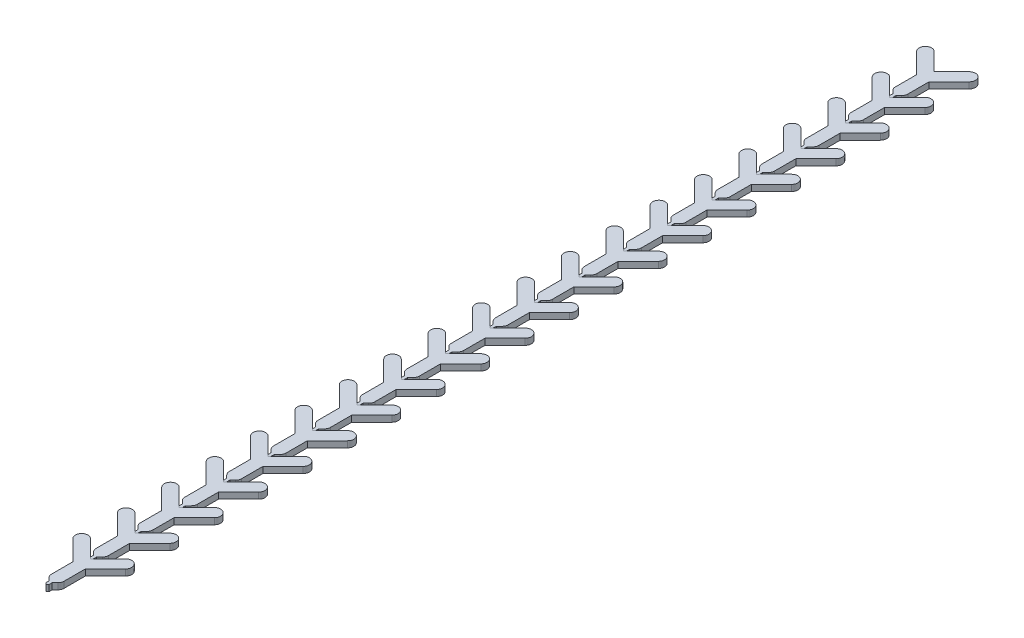
from build123d import *

# Parameters (mm, degrees)
BOSS_EXTRUDE1_DEPTH = 2
LPATTERN2_COUNT     = 20
LPATTERN2_PITCH     = 14.32


with BuildPart() as part:
    # Sketch1 → Boss-Extrude1 (new body)
    with BuildSketch(Plane(origin=(0, 0, 0), x_dir=(1, 0, 0), z_dir=(0, 1, 0))):
        with BuildLine():
            Line((-5.656854249, 8.485281374), (0, 2.828427125))
            Line((0, 2.828427125), (5.656854249, 8.485281374))
            ThreePointArc((5.656854249, 8.485281374), (8.485281374, 8.485281374), (8.485281374, 5.656854249))
            Line((8.485281374, 5.656854249), (2, -0.828427125))
            Line((2, -0.828427125), (2, -7.671572875))
            ThreePointArc((2, -7.671572875), (1.847759065, -8.43693974), (1.414213562, -9.085786438))
            Line((1.414213562, -9.085786438), (0.5, -10))
            Line((0.5, -10), (0.5, -11))
            Line((0.5, -11), (0, -11.5))
            Line((0, -11.5), (-0.5, -11))
            Line((-0.5, -11), (-0.5, -10))
            Line((-0.5, -10), (-1.414213562, -9.085786438))
            ThreePointArc((-1.414213562, -9.085786438), (-1.847759065, -8.43693974), (-2, -7.671572875))
            Line((-2, -7.671572875), (-2, -0.828427125))
            Line((-2, -0.828427125), (-8.485281374, 5.656854249))
            ThreePointArc((-8.485281374, 5.656854249), (-8.485281374, 8.485281374), (-5.656854249, 8.485281374))
        make_face()
    extrude(amount=BOSS_EXTRUDE1_DEPTH)


with BuildPart() as lpattern2_1:
    # LPattern2: pattern copy
    add(part.part.moved(Location(Vector(0, 0, 1) * (1 * LPATTERN2_PITCH))))


with BuildPart() as lpattern2_2:
    # LPattern2: pattern copy
    add(part.part.moved(Location(Vector(0, 0, 1) * (2 * LPATTERN2_PITCH))))


with BuildPart() as lpattern2_3:
    # LPattern2: pattern copy
    add(part.part.moved(Location(Vector(0, 0, 1) * (3 * LPATTERN2_PITCH))))


with BuildPart() as lpattern2_4:
    # LPattern2: pattern copy
    add(part.part.moved(Location(Vector(0, 0, 1) * (4 * LPATTERN2_PITCH))))


with BuildPart() as lpattern2_5:
    # LPattern2: pattern copy
    add(part.part.moved(Location(Vector(0, 0, 1) * (5 * LPATTERN2_PITCH))))


with BuildPart() as lpattern2_6:
    # LPattern2: pattern copy
    add(part.part.moved(Location(Vector(0, 0, 1) * (6 * LPATTERN2_PITCH))))


with BuildPart() as lpattern2_7:
    # LPattern2: pattern copy
    add(part.part.moved(Location(Vector(0, 0, 1) * (7 * LPATTERN2_PITCH))))


with BuildPart() as lpattern2_8:
    # LPattern2: pattern copy
    add(part.part.moved(Location(Vector(0, 0, 1) * (8 * LPATTERN2_PITCH))))


with BuildPart() as lpattern2_9:
    # LPattern2: pattern copy
    add(part.part.moved(Location(Vector(0, 0, 1) * (9 * LPATTERN2_PITCH))))


with BuildPart() as lpattern2_10:
    # LPattern2: pattern copy
    add(part.part.moved(Location(Vector(0, 0, 1) * (10 * LPATTERN2_PITCH))))


with BuildPart() as lpattern2_11:
    # LPattern2: pattern copy
    add(part.part.moved(Location(Vector(0, 0, 1) * (11 * LPATTERN2_PITCH))))


with BuildPart() as lpattern2_12:
    # LPattern2: pattern copy
    add(part.part.moved(Location(Vector(0, 0, 1) * (12 * LPATTERN2_PITCH))))


with BuildPart() as lpattern2_13:
    # LPattern2: pattern copy
    add(part.part.moved(Location(Vector(0, 0, 1) * (13 * LPATTERN2_PITCH))))


with BuildPart() as lpattern2_14:
    # LPattern2: pattern copy
    add(part.part.moved(Location(Vector(0, 0, 1) * (14 * LPATTERN2_PITCH))))


with BuildPart() as lpattern2_15:
    # LPattern2: pattern copy
    add(part.part.moved(Location(Vector(0, 0, 1) * (15 * LPATTERN2_PITCH))))


with BuildPart() as lpattern2_16:
    # LPattern2: pattern copy
    add(part.part.moved(Location(Vector(0, 0, 1) * (16 * LPATTERN2_PITCH))))


with BuildPart() as lpattern2_17:
    # LPattern2: pattern copy
    add(part.part.moved(Location(Vector(0, 0, 1) * (17 * LPATTERN2_PITCH))))


with BuildPart() as lpattern2_18:
    # LPattern2: pattern copy
    add(part.part.moved(Location(Vector(0, 0, 1) * (18 * LPATTERN2_PITCH))))


with BuildPart() as lpattern2_19:
    # LPattern2: pattern copy
    add(part.part.moved(Location(Vector(0, 0, 1) * (19 * LPATTERN2_PITCH))))


solid = Compound([part.part, lpattern2_1.part, lpattern2_2.part, lpattern2_3.part, lpattern2_4.part, lpattern2_5.part, lpattern2_6.part, lpattern2_7.part, lpattern2_8.part, lpattern2_9.part, lpattern2_10.part, lpattern2_11.part, lpattern2_12.part, lpattern2_13.part, lpattern2_14.part, lpattern2_15.part, lpattern2_16.part, lpattern2_17.part, lpattern2_18.part, lpattern2_19.part])
